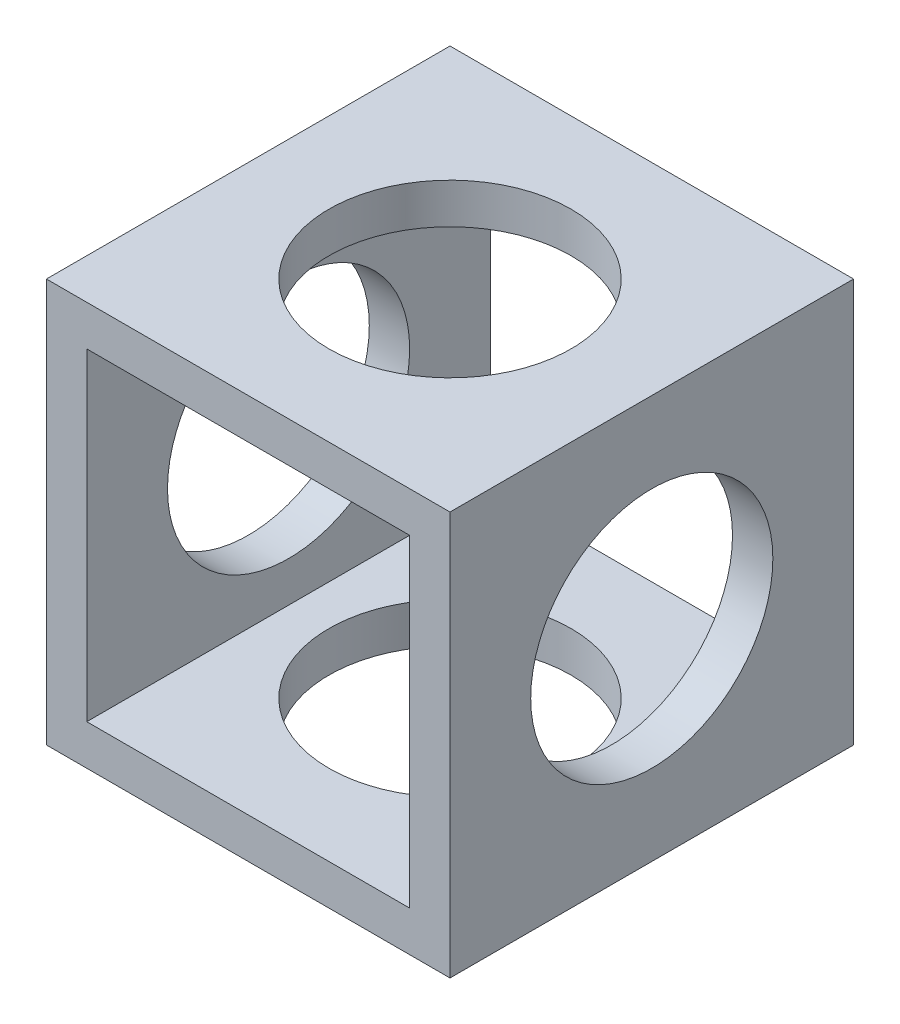
from build123d import *

# Parameters (mm, degrees)
CROQUIS1_W              = 50
CROQUIS1_H              = 50
CROQUIS1_W_2            = 40
CROQUIS1_H_2            = 40
SALIENTE_EXTRUIR1_DEPTH = 50
CROQUIS2_R              = 15
CORTAR_EXTRUIR1_DEPTH   = 76
CROQUIS3_R              = 15
CORTAR_EXTRUIR2_DEPTH   = 76


with BuildPart() as part:
    # Croquis1 → Saliente-Extruir1 (new body)
    with BuildSketch(Plane.XY):
        Rectangle(CROQUIS1_W, CROQUIS1_H)
        Rectangle(CROQUIS1_W_2, CROQUIS1_H_2, mode=Mode.SUBTRACT)
    extrude(amount=-SALIENTE_EXTRUIR1_DEPTH)

    # Croquis2 → Cortar-Extruir1 (cut, through all)
    with BuildSketch(Plane(origin=(25, 0, 0), x_dir=(0, 0, -1), z_dir=(1, 0, 0))):
        with Locations((25, 0)):
            Circle(CROQUIS2_R)
    extrude(amount=-CORTAR_EXTRUIR1_DEPTH, mode=Mode.SUBTRACT)

    # Croquis3 → Cortar-Extruir2 (cut, through all)
    with BuildSketch(Plane(origin=(0, 25, 0), x_dir=(1, 0, 0), z_dir=(0, 1, 0))):
        with Locations(Location((0, 25, 0), (0, 0, 270))):
            Circle(CROQUIS3_R)
    extrude(amount=-CORTAR_EXTRUIR2_DEPTH, mode=Mode.SUBTRACT)


solid = part.part
